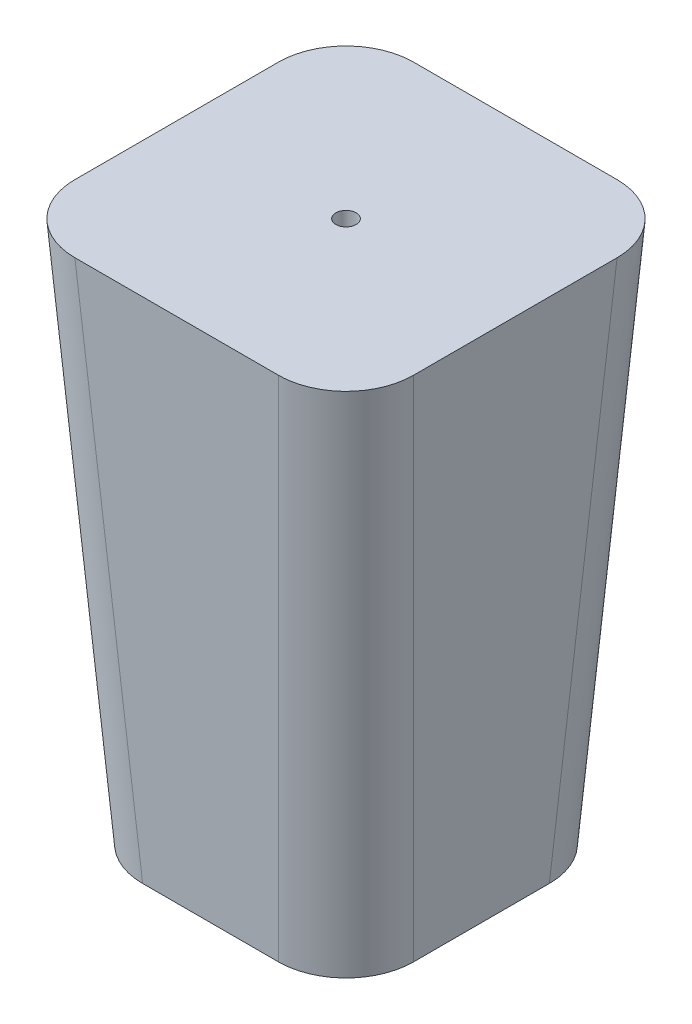
from build123d import *

# Parameters (mm, degrees)
SKETCH3_R          = 1.5
CUT_EXTRUDE1_DEPTH = 3
FILLET1_R          = 10


with BuildPart() as part:
    # Sketch2 → Loft1 section 0
    with BuildSketch(Plane(origin=(0, 80, 0), x_dir=(1, 0, 0), z_dir=(0, 1, 0))):
        with BuildLine():
            Line((-25, -25), (25, -25))
            Line((25, -25), (25, 25))
            Line((25, 25), (-25, 25))
            Line((-25, 25), (-25, -25))
        make_face()
    # Sketch1 → Loft1 section 1
    with BuildSketch(Plane(origin=(0, 0, 0), x_dir=(1, 0, 0), z_dir=(0, 1, 0))):
        with BuildLine():
            Line((-20, -20), (20, -20))
            Line((20, -20), (20, 20))
            Line((20, 20), (-20, 20))
            Line((-20, 20), (-20, -20))
        make_face()
    loft()

    # Sketch3 → Cut-Extrude1 (cut)
    with BuildSketch(Plane(origin=(0, 80, 0), x_dir=(1, 0, 0), z_dir=(0, 1, 0))):
        with Locations(Location((0, 0, 0), (0, 0, 270))):
            Circle(SKETCH3_R)
    cut_extrude1 = extrude(amount=-CUT_EXTRUDE1_DEPTH, mode=Mode.SUBTRACT)

    # Mirror1: Cut-Extrude1 across plane
    add(cut_extrude1.mirror(Plane.ZX.offset(40)), mode=Mode.SUBTRACT)

    # Fillet1
    fillet1_edges = [part.edges().sort_by_distance(p)[0] for p in [
        (-22.5, 40, 22.5),
        (-22.5, 40, -22.5),
        (22.5, 40, -22.5),
        (22.5, 40, 22.5),
    ]]
    fillet(fillet1_edges, radius=FILLET1_R)


solid = part.part
